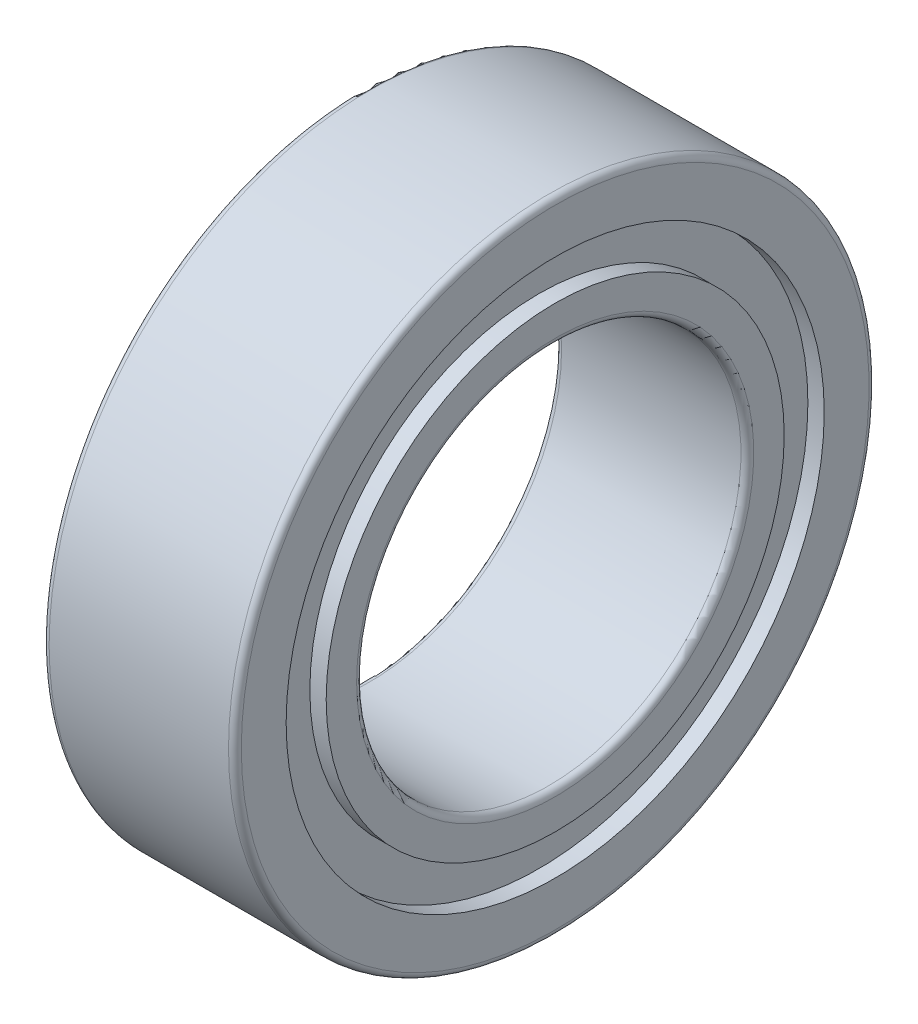
from build123d import *

# Parameters (mm, degrees)
FILLET1_R = 0.1
FILLET2_R = 0.1


with BuildPart() as part:
    # Sketch1 → Revolve1 (revolve)
    with BuildSketch(Plane.XY, mode=Mode.PRIVATE) as revolve1_sk:
        Polygon((0, 3), (3, 3), (3, 3.575), (2.745, 3.575), (2.745, 4.2), (3, 4.2), (3, 5), (0, 5), (0, 4.2), (0.255, 4.2), (0.255, 3.575), (0, 3.575), align=None)
    revolve(revolve1_sk.sketch.rotate(Axis((0, 0, 0), (1, 0, 0)), 90), axis=Axis((0, 0, 0), (1, 0, 0)))

    # Fillet1
    fillet1_edges = [part.edges().sort_by_distance(p)[0] for p in [
        (0, 0, -5),
        (3, 0, -5),
    ]]
    fillet(fillet1_edges, radius=FILLET1_R)

    # Fillet2
    fillet2_edges = [part.edges().sort_by_distance(p)[0] for p in [
        (3, 0, -3),
        (0, 0, -3),
    ]]
    fillet(fillet2_edges, radius=FILLET2_R)


solid = part.part
